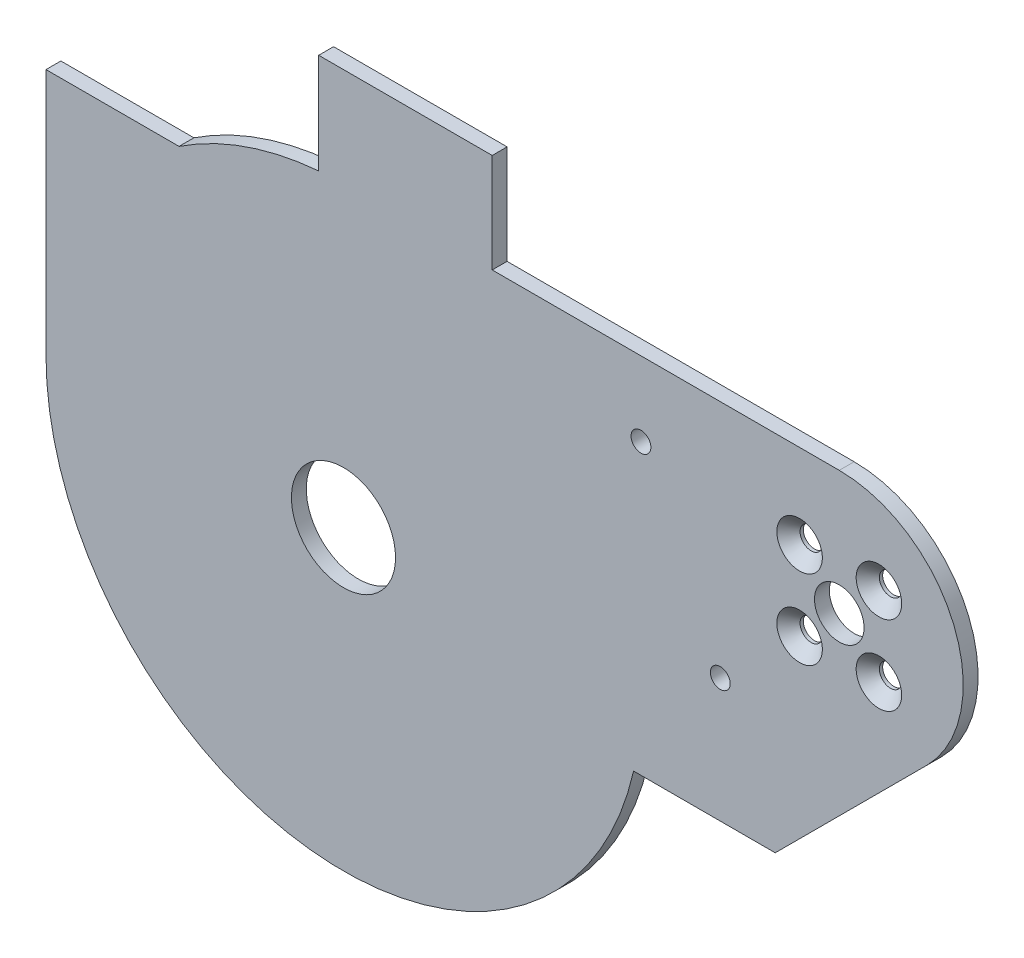
from build123d import *

# Parameters (mm, degrees)
SKETCH1_R                                    = 10.5
SKETCH1_R_2                                  = 5
BOSS_EXTRUDE1_DEPTH                          = 3
CUT_EXTRUDE1_REACH                           = 140.687
SKETCH2_R                                    = 2
BOSS_EXTRUDE2_DEPTH                          = 3
SKETCH4_W                                    = 2
SKETCH4_H                                    = 6.5
SKETCH4_W_2                                  = 6.5
SKETCH4_H_2                                  = 2
BOSS_EXTRUDE3_DEPTH                          = 1
SKETCH5_R                                    = 2
CUT_EXTRUDE2_DEPTH                           = 10
CSK_FOR_M4_HEX_SOCKET_COUNTERSUNK_HE_2_COUNT = 2
CSK_FOR_M4_HEX_SOCKET_COUNTERSUNK_HE_2_PITCH = 16
CSK_FOR_M4_HEX_SOCKET_COUNTERSUNK_HE_3_COUNT = 2
CSK_FOR_M4_HEX_SOCKET_COUNTERSUNK_HE_3_PITCH = 16
CSK_FOR_M4_HEX_SOCKET_COUNTERSUNK_HE_4_COUNT = 2
CSK_FOR_M4_HEX_SOCKET_COUNTERSUNK_HE_4_PITCH = 22.627416998


with BuildPart() as part:
    # Sketch1 → Boss-Extrude1 (new body)
    # profile 1 of 2: a face of its own
    with BuildSketch(Plane.XY):
        with BuildLine():
            ThreePointArc((-60, 0), (-52.867640737, 28.372743309), (-33.166247904, 50))
            Line((-33.166247904, 50), (-60, 50))
            Line((-60, 50), (-60, 0))
        make_face()
    # profile 2 of 2: a face of its own
    with BuildSketch(Plane.XY):
        with BuildLine():
            ThreePointArc((0, 60), (-17.320508076, 57.445626465), (-33.166247904, 50))
            ThreePointArc((-33.166247904, 50), (-52.867640737, 28.372743309), (-60, 0))
            ThreePointArc((-60, 0), (-6.678621673, -59.627141576), (58.513200418, -13.274237334))
            Line((58.513200418, -13.274237334), (87.081101726, -13.274237334))
            Line((87.081101726, -13.274237334), (117.67766953, 17.32233047))
            ThreePointArc((117.67766953, 17.32233047), (123.096988313, 44.567085809), (100, 60))
            Line((100, 60), (0, 60))
        make_face()
        Circle(SKETCH1_R, mode=Mode.SUBTRACT)
        with Locations((100, 35)):
            Circle(SKETCH1_R_2, mode=Mode.SUBTRACT)
    extrude(amount=BOSS_EXTRUDE1_DEPTH)

    # Sketch2 → Cut-Extrude1 (cut, up to next)
    with BuildSketch(Plane.XY.offset(3), mode=Mode.PRIVATE) as cut_extrude1_sk1:
        with Locations((60, 45)):
            Circle(SKETCH2_R)
    cut_extrude1_tool1 = extrude(cut_extrude1_sk1.sketch, amount=-CUT_EXTRUDE1_REACH, mode=Mode.PRIVATE) & part.part
    # Sketch2 → Cut-Extrude1 (cut, up to next)
    with BuildSketch(Plane.XY.offset(3), mode=Mode.PRIVATE) as cut_extrude1_sk2:
        with Locations((76, 11.725762666)):
            Circle(SKETCH2_R)
    cut_extrude1_tool2 = extrude(cut_extrude1_sk2.sketch, amount=-CUT_EXTRUDE1_REACH, mode=Mode.PRIVATE) & part.part
    add(cut_extrude1_tool1.solids().sort_by_distance((60, 45, 3))[0], mode=Mode.SUBTRACT)
    add(cut_extrude1_tool2.solids().sort_by_distance((76, 11.725763, 3))[0], mode=Mode.SUBTRACT)

    # Sketch3 → Boss-Extrude2 (add)
    with BuildSketch(Plane(origin=(0, 0, 0), x_dir=(-1, 0, 0), z_dir=(0, 0, -1))):
        with BuildLine():
            Line((-30, 80), (-30, 60))
            Line((-30, 60), (0, 60))
            ThreePointArc((0, 60), (2.502176759, 59.947803225), (5, 59.791303716))
            Line((5, 59.791303716), (5, 80))
            Line((5, 80), (-30, 80))
        make_face()
    extrude(amount=-BOSS_EXTRUDE2_DEPTH)

    # Sketch4 → Boss-Extrude3 (add)
    with BuildSketch(Plane(origin=(0, 0, 0), x_dir=(-1, 0, 0), z_dir=(0, 0, -1))):
        with Locations((-12.5, 68.846087829)):
            Rectangle(SKETCH4_W, SKETCH4_H)
        with Locations((-16.75, 64.596087829)):
            Rectangle(SKETCH4_W_2, SKETCH4_H_2)
        with Locations((-12.5, 64.596087829)):
            Rectangle(SKETCH4_W, SKETCH4_H_2)
        with Locations((-8.25, 64.596087829)):
            Rectangle(SKETCH4_W_2, SKETCH4_H_2)
        with Locations((-12.5, 60.346087829)):
            Rectangle(SKETCH4_W, SKETCH4_H)
    extrude(amount=BOSS_EXTRUDE3_DEPTH)

    # Sketch5 → Cut-Extrude2 (cut)
    with BuildSketch(Plane.XY.offset(3)):
        with Locations((92, 43)):
            Circle(SKETCH5_R)
        with Locations((108, 43)):
            Circle(SKETCH5_R)
        with Locations((108, 27)):
            Circle(SKETCH5_R)
        with Locations((92, 27)):
            Circle(SKETCH5_R)
    extrude(amount=-CUT_EXTRUDE2_DEPTH, mode=Mode.SUBTRACT)

    # Sketch8 → CSK for M4 Hex Socket Countersunk Head Screw1 (revolve, cut)
    with BuildSketch(Plane(origin=(92, 43, 3), x_dir=(0, -1, 0), z_dir=(1, 0, 0))):
        Polygon((0, 0), (0, 4), (2.25, 4), (2.25, 2.34), (4.59, 0), align=None)
    csk_for_m4_hex_socket_countersunk_head_s = revolve(axis=Axis((92, 43, 9.35), (0, 0, -1)), mode=Mode.SUBTRACT)

    # CSK for M4 Hex Socket Countersunk He 2: CSK for M4 Hex Socket Countersunk Head Screw1 ×2
    with Locations(*[(i * CSK_FOR_M4_HEX_SOCKET_COUNTERSUNK_HE_2_PITCH, 0, 0) for i in range(1, CSK_FOR_M4_HEX_SOCKET_COUNTERSUNK_HE_2_COUNT)]):
        add(csk_for_m4_hex_socket_countersunk_head_s, mode=Mode.SUBTRACT)

    # CSK for M4 Hex Socket Countersunk He 3: CSK for M4 Hex Socket Countersunk Head Screw1 ×2
    with Locations(*[(0, -i * CSK_FOR_M4_HEX_SOCKET_COUNTERSUNK_HE_3_PITCH, 0) for i in range(1, CSK_FOR_M4_HEX_SOCKET_COUNTERSUNK_HE_3_COUNT)]):
        add(csk_for_m4_hex_socket_countersunk_head_s, mode=Mode.SUBTRACT)

    # CSK for M4 Hex Socket Countersunk He 4: CSK for M4 Hex Socket Countersunk Head Screw1 ×2
    with Locations(*[Vector(0.7071067811865472, -0.7071067811865478, 0) * (i * CSK_FOR_M4_HEX_SOCKET_COUNTERSUNK_HE_4_PITCH) for i in range(1, CSK_FOR_M4_HEX_SOCKET_COUNTERSUNK_HE_4_COUNT)]):
        add(csk_for_m4_hex_socket_countersunk_head_s, mode=Mode.SUBTRACT)


solid = part.part
